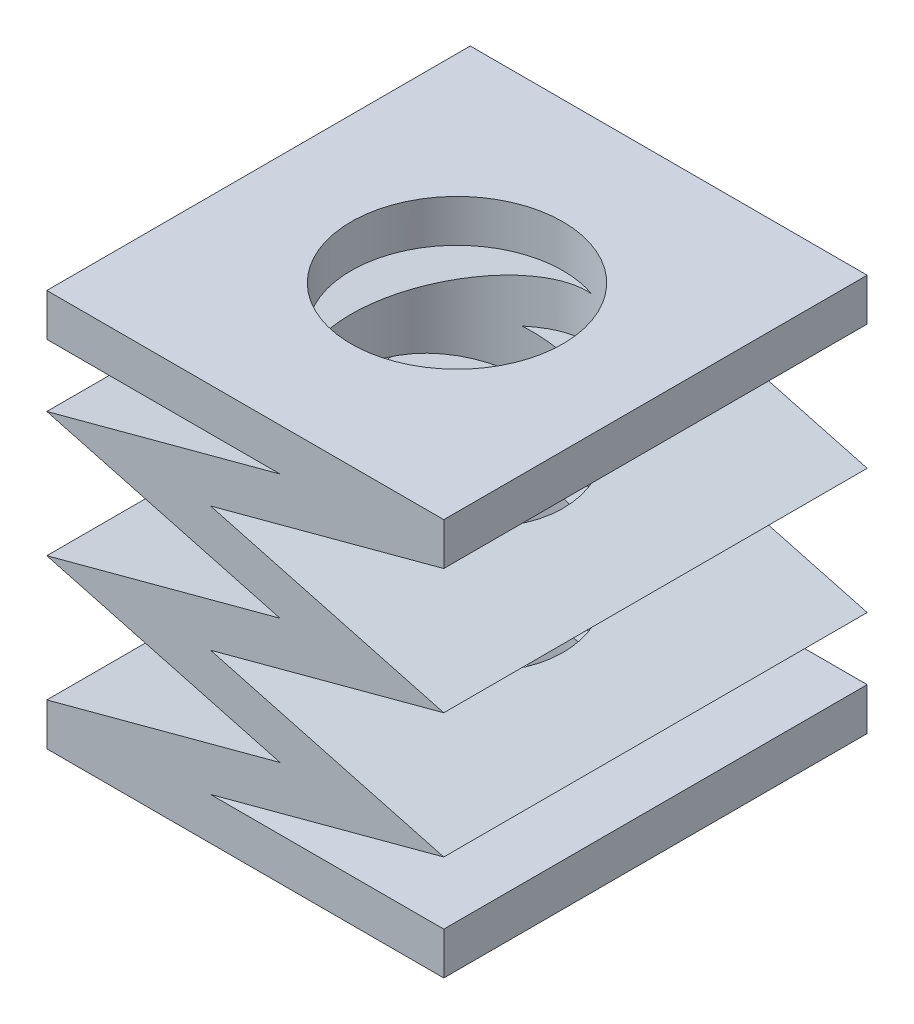
from build123d import *

# Parameters (mm, degrees)
BOSS_EXTRUDE3_DEPTH = 8
SKETCH4_R           = 2
CUT_EXTRUDE3_DEPTH  = 14.285330256


with BuildPart() as part:
    # Sketch3 → Boss-Extrude3 (new body)
    with BuildSketch(Plane.XY):
        Polygon((7.5, 0), (3.09302731, 0), (0, 0), (0, -0.8), (7.5, -0.8), align=None)
        Polygon((4.40697269, 5.9), (7.5, 5.9), (3.09302731, 4.72), (7.5, 3.54), (3.09302731, 2.36), (7.5, 1.18), (3.09302731, 0), (0, 0), (4.40697269, 1.18), (0, 2.36), (4.40697269, 3.54), (0, 4.72), align=None)
        Polygon((4.40697269, 5.9), (7.5, 5.9), (7.5, 6.7), (0, 6.7), (0, 5.9), align=None)
    extrude(amount=BOSS_EXTRUDE3_DEPTH)

    # Sketch4 → Cut-Extrude3 (cut, through all)
    with BuildSketch(Plane.XZ.offset(0.8)):
        with Locations(Location((3.75, 4, 0), (0, 0, 270))):
            Circle(SKETCH4_R)
    extrude(amount=-CUT_EXTRUDE3_DEPTH, mode=Mode.SUBTRACT)


solid = part.part
